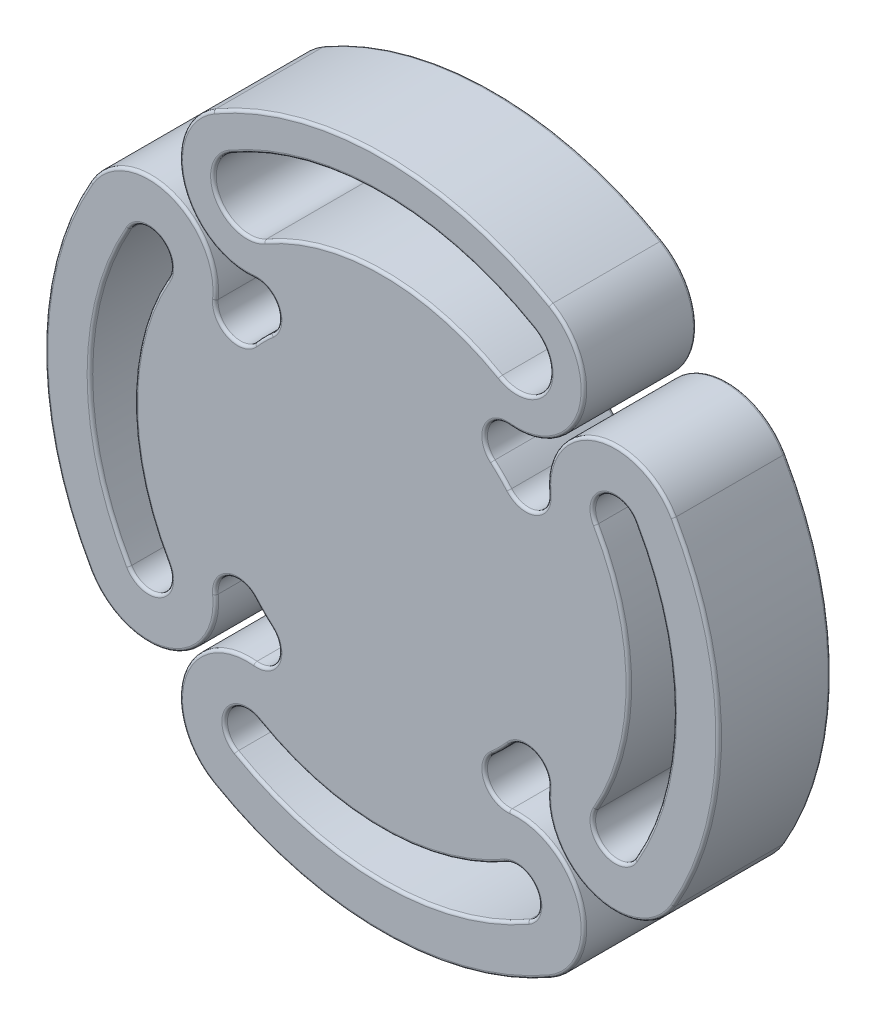
from build123d import *

# Parameters (mm, degrees)
EXTRUDE_THIN1_DEPTH   = 5
EXTRUDE_THIN1_2_DEPTH = 5
EXTRUDE_THIN1_3_DEPTH = 5
BOSS_EXTRUDE1_DEPTH   = 5
FILLET1_R             = 0.25


with BuildPart() as part:
    # Sketch1 → Extrude-Thin1 (new, symmetric)
    with BuildSketch(Plane.XY):
        with BuildLine():
            ThreePointArc((18.186533479, 10.5), (21, 0), (18.186533479, -10.5))
            ThreePointArc((18.186533479, -10.5), (19.284609691, -14.598076211), (23.382685902, -13.5))
            ThreePointArc((23.382685902, -13.5), (27, 0), (23.382685902, 13.5))
            ThreePointArc((23.382685902, 13.5), (19.284609691, 14.598076211), (18.186533479, 10.5))
        make_face()
        with BuildLine():
            ThreePointArc((19.052558883, 11), (22, 0), (19.052558883, -11))
            ThreePointArc((19.052558883, -11), (19.784609691, -13.732050808), (22.516660498, -13))
            ThreePointArc((22.516660498, -13), (26, 0), (22.516660498, 13))
            ThreePointArc((22.516660498, 13), (19.784609691, 13.732050808), (19.052558883, 11))
        make_face(mode=Mode.SUBTRACT)
    extrude(amount=EXTRUDE_THIN1_DEPTH, both=True)



with BuildPart() as body_2:
    # Sketch1 → Extrude-Thin1 2 (new, symmetric)
    with BuildSketch(Plane.XY):
        with BuildLine():
            ThreePointArc((10.5, -18.186533479), (0, -21), (-10.5, -18.186533479))
            ThreePointArc((-10.5, -18.186533479), (-14.598076211, -19.284609691), (-13.5, -23.382685902))
            ThreePointArc((-13.5, -23.382685902), (0, -27), (13.5, -23.382685902))
            ThreePointArc((13.5, -23.382685902), (14.598076211, -19.284609691), (10.5, -18.186533479))
        make_face()
        with BuildLine():
            ThreePointArc((11, -19.052558883), (0, -22), (-11, -19.052558883))
            ThreePointArc((-11, -19.052558883), (-13.732050808, -19.784609691), (-13, -22.516660498))
            ThreePointArc((-13, -22.516660498), (0, -26), (13, -22.516660498))
            ThreePointArc((13, -22.516660498), (13.732050808, -19.784609691), (11, -19.052558883))
        make_face(mode=Mode.SUBTRACT)
    extrude(amount=EXTRUDE_THIN1_2_DEPTH, both=True)


with BuildPart() as body_3:
    # Sketch1 → Extrude-Thin1 3 (new, symmetric)
    with BuildSketch(Plane.XY):
        with BuildLine():
            ThreePointArc((-18.186533479, -10.5), (-21, 0), (-18.186533479, 10.5))
            ThreePointArc((-18.186533479, 10.5), (-19.284609691, 14.598076211), (-23.382685902, 13.5))
            ThreePointArc((-23.382685902, 13.5), (-27, 0), (-23.382685902, -13.5))
            ThreePointArc((-23.382685902, -13.5), (-19.284609691, -14.598076211), (-18.186533479, -10.5))
        make_face()
        with BuildLine():
            ThreePointArc((-19.052558883, -11), (-22, 0), (-19.052558883, 11))
            ThreePointArc((-19.052558883, 11), (-19.784609691, 13.732050808), (-22.516660498, 13))
            ThreePointArc((-22.516660498, 13), (-26, 0), (-22.516660498, -13))
            ThreePointArc((-22.516660498, -13), (-19.784609691, -13.732050808), (-19.052558883, -11))
        make_face(mode=Mode.SUBTRACT)
    extrude(amount=EXTRUDE_THIN1_3_DEPTH, both=True)


with BuildPart() as part_1:
    add(part.part)

    add(body_2.part)  # Boss-Extrude1 merges body 2

    add(body_3.part)  # Boss-Extrude1 merges body 3
    # Sketch1<3> → Boss-Extrude1 (add, symmetric)
    # profile 1 of 4: a face of its own
    with BuildSketch(Plane.XY):
        with BuildLine():
            ThreePointArc((11.36523347, 14.818281553), (9.32005242, 13.628216731), (9.841451141, 11.320151918))
            ThreePointArc((9.841451141, 11.320151918), (0, -15), (-9.841451141, 11.320151918))
            ThreePointArc((-9.841451141, 11.320151918), (-9.32005242, 13.628216731), (-11.36523347, 14.818281553))
            ThreePointArc((-11.36523347, 14.818281553), (-17.70515779, 18.926875967), (-15, 25.980762114))
            ThreePointArc((-15, 25.980762114), (0, 30), (15, 25.980762114))
            ThreePointArc((15, 25.980762114), (17.70515779, 18.926875967), (11.36523347, 14.818281553))
        make_face()
        with BuildLine():
            ThreePointArc((-13.5, 23.382685902), (-14.598076211, 19.284609691), (-10.5, 18.186533479))
            ThreePointArc((-10.5, 18.186533479), (0, 21), (10.5, 18.186533479))
            ThreePointArc((10.5, 18.186533479), (14.598076211, 19.284609691), (13.5, 23.382685902))
            ThreePointArc((13.5, 23.382685902), (0, 27), (-13.5, 23.382685902))
        make_face(mode=Mode.SUBTRACT)
    # profile 2 of 4: a face of its own
    with BuildSketch(Plane.XY):
        with BuildLine():
            ThreePointArc((-11.320151918, -9.841451141), (-15, 0), (-11.320151918, 9.841451141))
            ThreePointArc((-11.320151918, 9.841451141), (-13.628216731, 9.32005242), (-14.818281553, 11.36523347))
            ThreePointArc((-14.818281553, 11.36523347), (-18.926875967, 17.70515779), (-25.980762114, 15))
            ThreePointArc((-25.980762114, 15), (-30, 0), (-25.980762114, -15))
            ThreePointArc((-25.980762114, -15), (-18.926875967, -17.70515779), (-14.818281553, -11.36523347))
            ThreePointArc((-14.818281553, -11.36523347), (-13.628216731, -9.32005242), (-11.320151918, -9.841451141))
        make_face()
        with BuildLine():
            ThreePointArc((-23.382685902, -13.5), (-27, 0), (-23.382685902, 13.5))
            ThreePointArc((-23.382685902, 13.5), (-19.284609691, 14.598076211), (-18.186533479, 10.5))
            ThreePointArc((-18.186533479, 10.5), (-21, 0), (-18.186533479, -10.5))
            ThreePointArc((-18.186533479, -10.5), (-19.284609691, -14.598076211), (-23.382685902, -13.5))
        make_face(mode=Mode.SUBTRACT)
    # profile 3 of 4: a face of its own
    with BuildSketch(Plane.XY):
        with BuildLine():
            ThreePointArc((11.320151918, 9.841451141), (15, 0), (11.320151918, -9.841451141))
            ThreePointArc((11.320151918, -9.841451141), (13.628216731, -9.32005242), (14.818281553, -11.36523347))
            ThreePointArc((14.818281553, -11.36523347), (18.926875967, -17.70515779), (25.980762114, -15))
            ThreePointArc((25.980762114, -15), (30, 0), (25.980762114, 15))
            ThreePointArc((25.980762114, 15), (18.926875967, 17.70515779), (14.818281553, 11.36523347))
            ThreePointArc((14.818281553, 11.36523347), (13.628216731, 9.32005242), (11.320151918, 9.841451141))
        make_face()
        with BuildLine():
            ThreePointArc((23.382685902, 13.5), (27, 0), (23.382685902, -13.5))
            ThreePointArc((23.382685902, -13.5), (19.284609691, -14.598076211), (18.186533479, -10.5))
            ThreePointArc((18.186533479, -10.5), (21, 0), (18.186533479, 10.5))
            ThreePointArc((18.186533479, 10.5), (19.284609691, 14.598076211), (23.382685902, 13.5))
        make_face(mode=Mode.SUBTRACT)
    # profile 4 of 4: a face of its own
    with BuildSketch(Plane.XY):
        with BuildLine():
            ThreePointArc((9.841451141, -11.320151918), (0, -15), (-9.841451141, -11.320151918))
            ThreePointArc((-9.841451141, -11.320151918), (-9.32005242, -13.628216731), (-11.36523347, -14.818281553))
            ThreePointArc((-11.36523347, -14.818281553), (-17.70515779, -18.926875967), (-15, -25.980762114))
            ThreePointArc((-15, -25.980762114), (0, -30), (15, -25.980762114))
            ThreePointArc((15, -25.980762114), (17.70515779, -18.926875967), (11.36523347, -14.818281553))
            ThreePointArc((11.36523347, -14.818281553), (9.32005242, -13.628216731), (9.841451141, -11.320151918))
        make_face()
        with BuildLine():
            ThreePointArc((13.5, -23.382685902), (0, -27), (-13.5, -23.382685902))
            ThreePointArc((-13.5, -23.382685902), (-14.598076211, -19.284609691), (-10.5, -18.186533479))
            ThreePointArc((-10.5, -18.186533479), (0, -21), (10.5, -18.186533479))
            ThreePointArc((10.5, -18.186533479), (14.598076211, -19.284609691), (13.5, -23.382685902))
        make_face(mode=Mode.SUBTRACT)
    extrude(amount=BOSS_EXTRUDE1_DEPTH, both=True)

    # Fillet1
    fillet1_edges = [part_1.edges().sort_by_distance(p)[0] for p in [
        (22, 0, 5),
        (26, 0, -5),
        (19.784609691, 13.732050808, -5),
        (19.784609691, -13.732050808, -5),
        (26, 0, 5),
        (19.784609691, 13.732050808, 5),
        (22, 0, -5),
        (19.784609691, -13.732050808, 5),
        (0, -22, 5),
        (0, -26, -5),
        (13.732050808, -19.784609691, -5),
        (-13.732050808, -19.784609691, -5),
        (0, -26, 5),
        (13.732050808, -19.784609691, 5),
        (0, -22, -5),
        (-13.732050808, -19.784609691, 5),
        (-26, 0, -5),
        (-19.784609691, -13.732050808, -5),
        (-22, 0, 5),
        (-19.784609691, 13.732050808, -5),
        (-26, 0, 5),
        (-19.784609691, -13.732050808, 5),
        (-19.784609691, 13.732050808, 5),
        (-22, 0, -5),
        (-14.598076211, 19.284609691, 5),
        (0, 27, 5),
        (14.598076211, 19.284609691, 5),
        (9.32005242, 13.628216731, 5),
        (17.70515779, 18.926875967, -5),
        (0, 30, -5),
        (-17.70515779, 18.926875967, -5),
        (-9.32005242, 13.628216731, -5),
        (-10.606601718, 10.606601718, -5),
        (-13.628216731, 9.32005242, 5),
        (-18.926875967, 17.70515779, -5),
        (-30, 0, -5),
        (-18.926875967, -17.70515779, -5),
        (-13.628216731, -9.32005242, -5),
        (-10.606601718, -10.606601718, -5),
        (-9.32005242, -13.628216731, 5),
        (-17.70515779, -18.926875967, -5),
        (0, -30, -5),
        (17.70515779, -18.926875967, -5),
        (9.32005242, -13.628216731, -5),
        (10.606601718, -10.606601718, -5),
        (13.628216731, -9.32005242, 5),
        (18.926875967, -17.70515779, -5),
        (30, 0, -5),
        (18.926875967, 17.70515779, -5),
        (13.628216731, 9.32005242, -5),
        (0, 21, -5),
        (10.606601718, 10.606601718, -5),
        (17.70515779, 18.926875967, 5),
        (0, 30, 5),
        (-17.70515779, 18.926875967, 5),
        (-9.32005242, 13.628216731, 5),
        (-10.606601718, 10.606601718, 5),
        (-18.926875967, 17.70515779, 5),
        (-30, 0, 5),
        (-18.926875967, -17.70515779, 5),
        (-13.628216731, -9.32005242, 5),
        (-10.606601718, -10.606601718, 5),
        (-17.70515779, -18.926875967, 5),
        (0, -30, 5),
        (17.70515779, -18.926875967, 5),
        (9.32005242, -13.628216731, 5),
        (10.606601718, -10.606601718, 5),
        (18.926875967, -17.70515779, 5),
        (30, 0, 5),
        (18.926875967, 17.70515779, 5),
        (13.628216731, 9.32005242, 5),
        (10.606601718, 10.606601718, 5),
        (0, 21, 5),
        (9.32005242, 13.628216731, -5),
        (13.628216731, -9.32005242, -5),
        (-9.32005242, -13.628216731, -5),
        (-13.628216731, 9.32005242, -5),
        (-14.598076211, 19.284609691, -5),
        (14.598076211, 19.284609691, -5),
        (0, 27, -5),
    ]]
    fillet(fillet1_edges, radius=FILLET1_R)


solid = part_1.part
